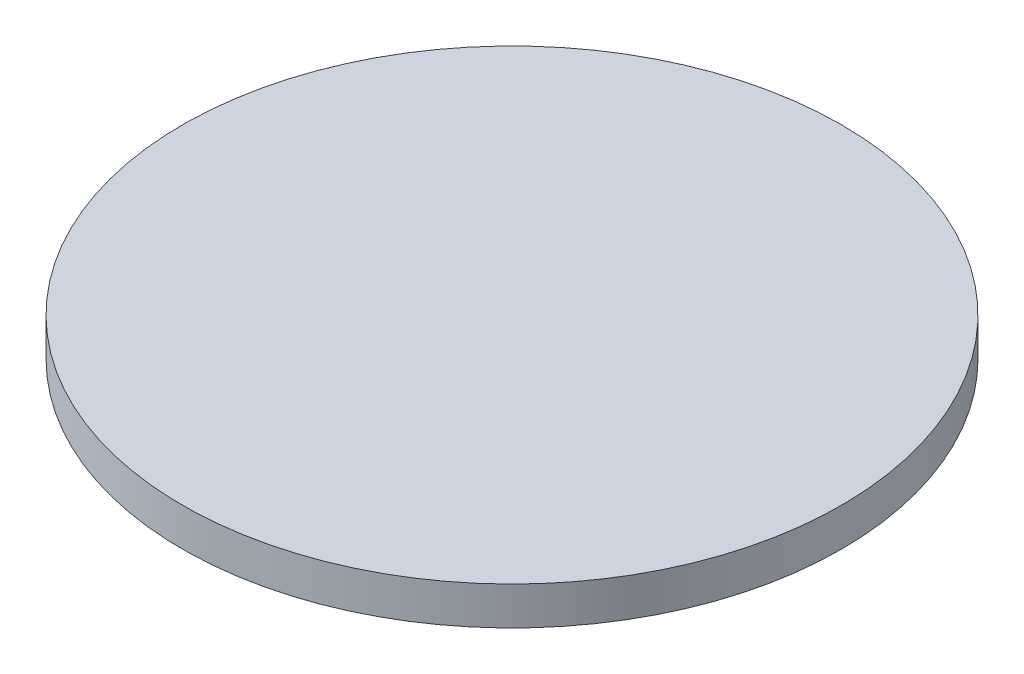
from build123d import *


with BuildPart() as part:
    # Sketch1 → Revolve1 (revolve)
    with BuildSketch(Plane.XY):
        with BuildLine():
            Line((0, 0), (0, 29))
            Line((0, 29), (0, 40))
            Line((0, 40), (95.25, 40))
            Line((95.25, 40), (95.25, 29))
            ThreePointArc((95.25, 29), (49.783437256, 7.410650048), (0, 0))
        make_face()
    revolve(axis=Axis((0, 0, 0), (0, 1, 0)))


solid = part.part
